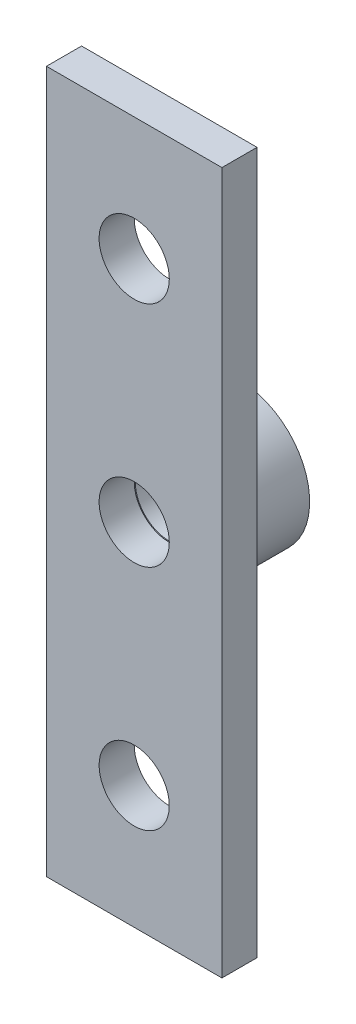
from build123d import *

# Parameters (mm, degrees)
IZIM1_W                     = 10
IZIM1_H                     = 40
IZIM1_R                     = 2
Y_KSEKLIK_EKSTR_ZYON1_DEPTH = 2
IZIM2_R                     = 4
IZIM2_R_2                   = 1.937571625
Y_KSEKLIK_EKSTR_ZYON2_DEPTH = 4


with BuildPart() as part:
    # Çizim1 → Yükseklik-Ekstrüzyon1 (new body)
    with BuildSketch(Plane.XY):
        with Locations((5, 20)):
            Rectangle(IZIM1_W, IZIM1_H)
        with Locations((5, 20)):
            Circle(IZIM1_R, mode=Mode.SUBTRACT)
        with Locations((5, 33)):
            Circle(IZIM1_R, mode=Mode.SUBTRACT)
        with Locations(Location((5, 7, 0), (0, 0, 180))):
            Circle(IZIM1_R, mode=Mode.SUBTRACT)
    extrude(amount=Y_KSEKLIK_EKSTR_ZYON1_DEPTH)

    # Çizim2 → Yükseklik-Ekstrüzyon2 (add)
    with BuildSketch(Plane(origin=(0, 0, 0), x_dir=(-1, 0, 0), z_dir=(0, 0, -1))):
        with Locations((-5, 20)):
            Circle(IZIM2_R)
        with Locations((-5, 20)):
            Circle(IZIM2_R_2, mode=Mode.SUBTRACT)
    extrude(amount=Y_KSEKLIK_EKSTR_ZYON2_DEPTH)


solid = part.part
